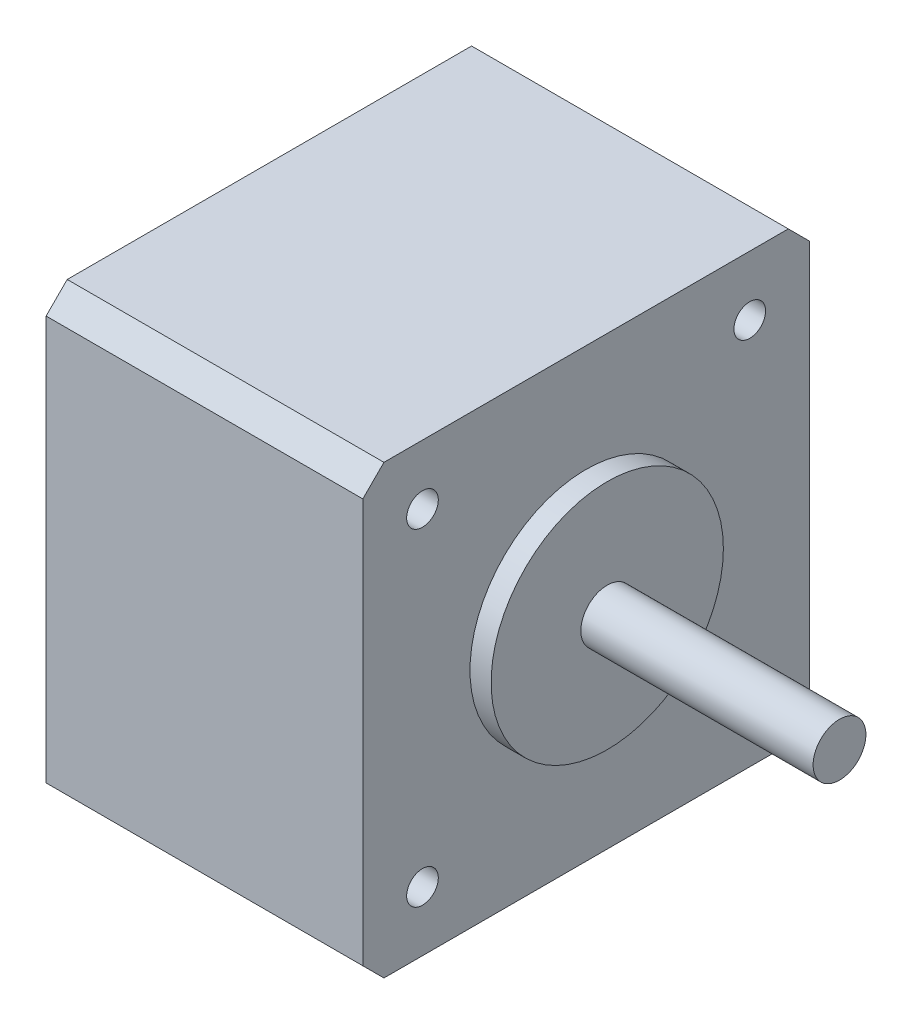
from build123d import *

# Parameters (mm, degrees)
SKETCH_1_W          = 42.3
SKETCH_1_H          = 42.3
EXTRUDE_1_DEPTH     = 30
CHAMFER_1_SIZE      = 2
SKETCH_2_R          = 1.5
CUT_EXTRUDE_1_DEPTH = 3
SKETCH_3_R          = 11
EXTRUDE_2_DEPTH     = 2
SKETCH_4_R          = 2.5
EXTRUDE_3_DEPTH     = 22


with BuildPart() as part:
    # 草图1 → 凸台-拉伸1 (new body)
    with BuildSketch(Plane(origin=(0, 0, 0), x_dir=(0, 0, -1), z_dir=(1, 0, 0))):
        Rectangle(SKETCH_1_W, SKETCH_1_H)
    extrude(amount=EXTRUDE_1_DEPTH)

    # 倒角1
    chamfer_1_edges = [part.edges().sort_by_distance(p)[0] for p in [
        (15, 21.15, 21.15),
        (15, 21.15, -21.15),
        (15, -21.15, -21.15),
        (15, -21.15, 21.15),
    ]]
    chamfer(chamfer_1_edges, length=CHAMFER_1_SIZE)

    # 草图2 → 切除-拉伸1 (cut)
    with BuildSketch(Plane(origin=(30, 0, 0), x_dir=(0, 0, -1), z_dir=(1, 0, 0))):
        with Locations((-15.5, 15.5)):
            Circle(SKETCH_2_R)
        with Locations((15.5, 15.5)):
            Circle(SKETCH_2_R)
        with Locations((15.5, -15.5)):
            Circle(SKETCH_2_R)
        with Locations((-15.5, -15.5)):
            Circle(SKETCH_2_R)
    extrude(amount=-CUT_EXTRUDE_1_DEPTH, mode=Mode.SUBTRACT)

    # 草图3 → 凸台-拉伸2 (add)
    with BuildSketch(Plane(origin=(30, 0, 0), x_dir=(0, 0, -1), z_dir=(1, 0, 0))):
        Circle(SKETCH_3_R)
    extrude(amount=EXTRUDE_2_DEPTH)

    # 草图4 → 凸台-拉伸3 (add)
    with BuildSketch(Plane(origin=(32, 0, 0), x_dir=(0, 0, -1), z_dir=(1, 0, 0))):
        Circle(SKETCH_4_R)
    extrude(amount=EXTRUDE_3_DEPTH)


solid = part.part
